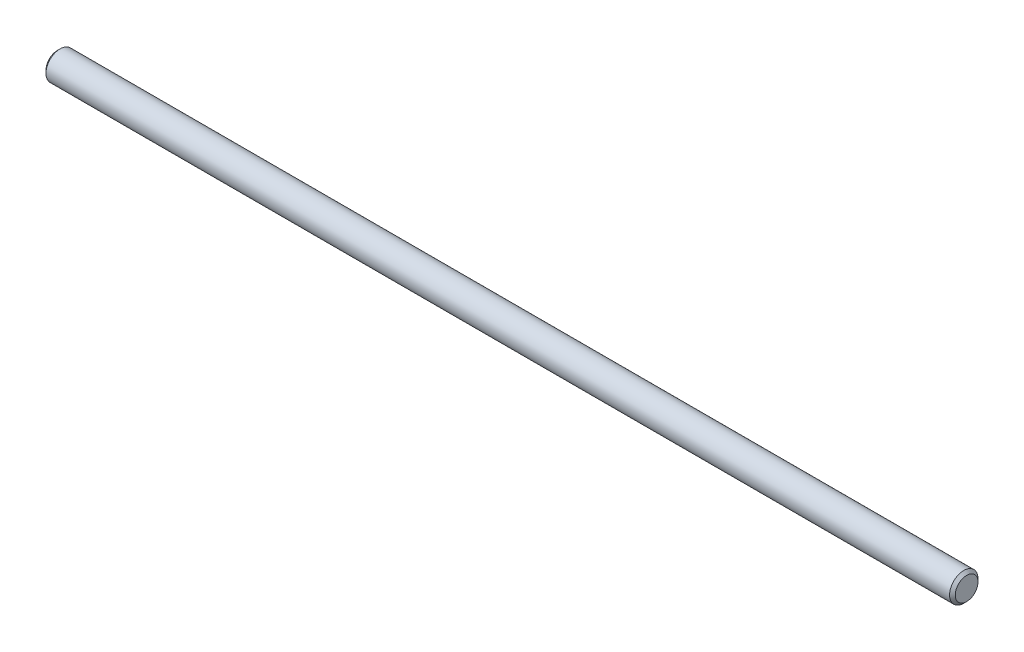
from build123d import *

# Parameters (mm, degrees)
EXTRUDE1_DEPTH      = 25.4
EXTRUDE1_DEPTH_BACK = 25.4
SKETCH2_R           = 0.79375
CHAMFER1_SIZE       = 0.15875


with BuildPart() as part:
    # Sketch2 → Extrude1 (new, two sides: drawn at the far end of the back side and taken through both)
    with BuildSketch(Plane(origin=(0, 0, 0), x_dir=(0, 0, -1), z_dir=(1, 0, 0)).offset(-EXTRUDE1_DEPTH_BACK)):
        Circle(SKETCH2_R)
    extrude(amount=EXTRUDE1_DEPTH + EXTRUDE1_DEPTH_BACK)

    # Chamfer1
    chamfer1_edges = [part.edges().sort_by_distance(p)[0] for p in [
        (-25.4, 0, 0.79375),
        (25.4, 0, 0.79375),
    ]]
    chamfer(chamfer1_edges, length=CHAMFER1_SIZE)


solid = part.part
